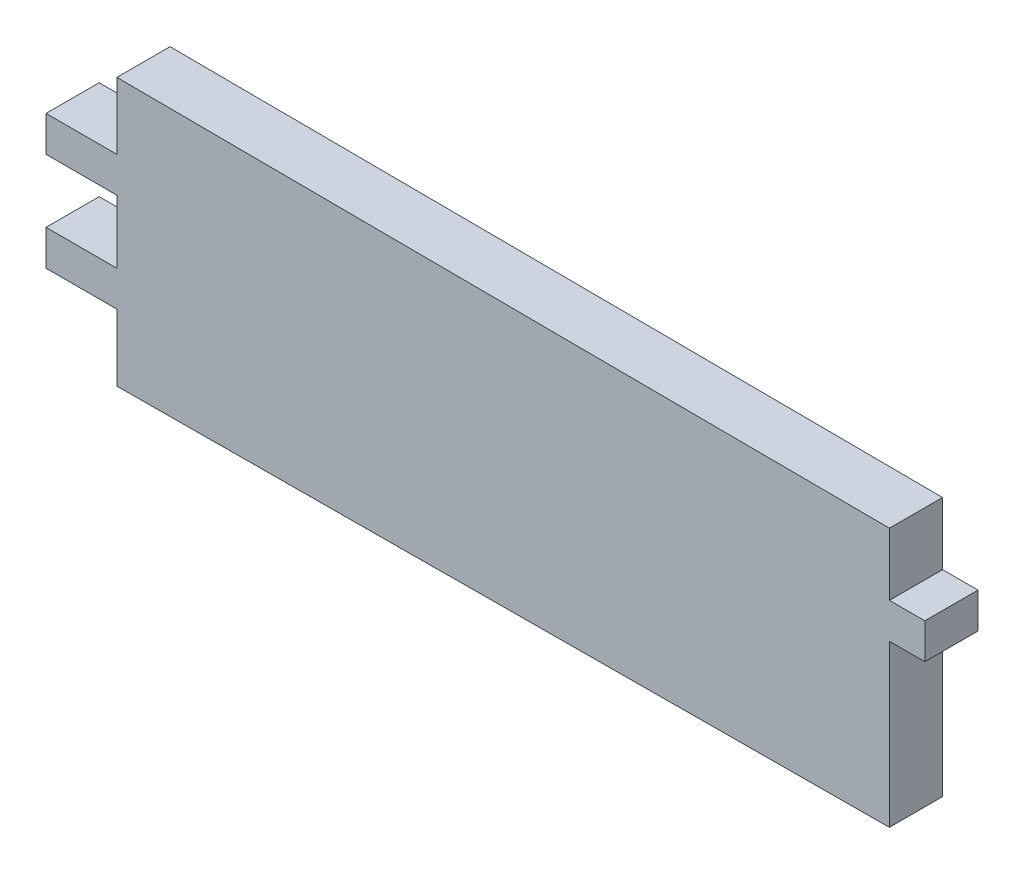
from build123d import *

# Parameters (mm, degrees)
BOSS_EXTRUDE1_DEPTH = 4.7625


with BuildPart() as part:
    # Sketch1 → Boss-Extrude1 (new body)
    with BuildSketch(Plane.XY):
        Polygon((-75.840358597, 8.279796389), (-69.490358597, 8.279796389), (-69.490358597, 14.25261076), (-0.275358597, 13.878851912), (-0.275358597, 8.279796389), (2.899641403, 8.279796389), (2.899641403, 5.104796389), (-0.275358597, 5.104796389), (-0.275358597, -9.333443508), (-69.490358597, -9.707188005), (-69.490358597, -3.734403611), (-75.840358597, -3.734403611), (-75.840358597, -0.559403611), (-69.490358597, -0.559403611), (-69.490358597, 5.104796389), (-75.840358597, 5.104796389), align=None)
    extrude(amount=BOSS_EXTRUDE1_DEPTH)


solid = part.part
